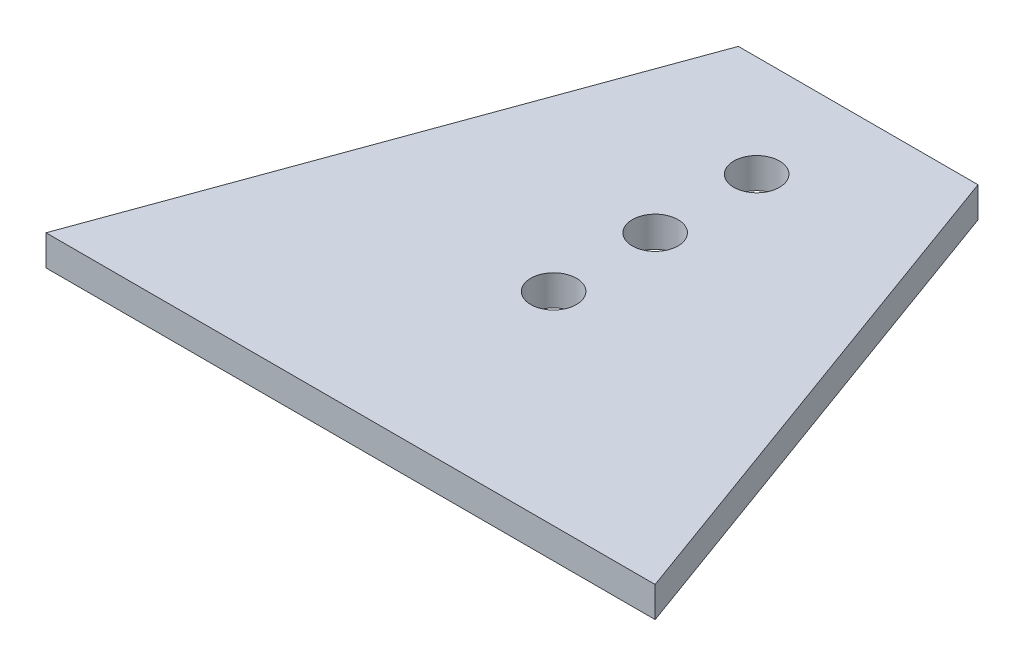
from build123d import *

# Parameters (mm, degrees)
SKETCH_1_R      = 2.25
EXTRUDE_1_DEPTH = 3


with BuildPart() as part:
    # 草图1 → 凸台-拉伸1 (new body)
    with BuildSketch(Plane(origin=(0, 0, 0), x_dir=(1, 0, 0), z_dir=(0, 1, 0))):
        Polygon((0, 0), (60, 0), (41.801488287, 50), (18.198511713, 50), align=None)
        with Locations(Location((30, 30, 0), (0, 0, 270))):
            Circle(SKETCH_1_R, mode=Mode.SUBTRACT)
        with Locations(Location((30, 20, 0), (0, 0, 270))):
            Circle(SKETCH_1_R, mode=Mode.SUBTRACT)
        with Locations(Location((30, 40, 0), (0, 0, 270))):
            Circle(SKETCH_1_R, mode=Mode.SUBTRACT)
    extrude(amount=EXTRUDE_1_DEPTH)


solid = part.part
